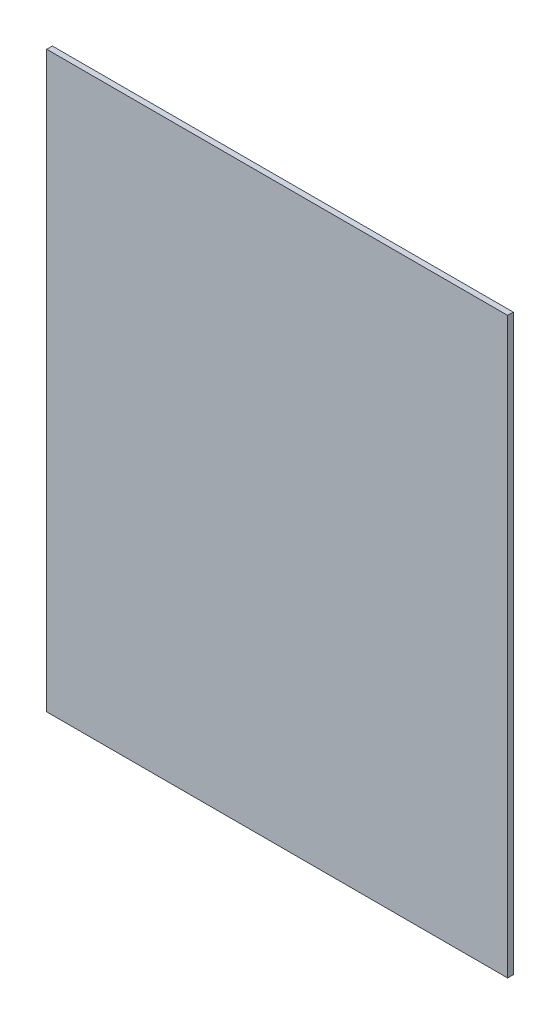
from build123d import *

# Parameters (mm, degrees)
SKETCH1_W           = 400
SKETCH1_H           = 498
BOSS_EXTRUDE1_DEPTH = 4.9


with BuildPart() as part:
    # Sketch1 → Boss-Extrude1 (new body)
    with BuildSketch(Plane.XY):
        with Locations((200, 249)):
            Rectangle(SKETCH1_W, SKETCH1_H)
    extrude(amount=BOSS_EXTRUDE1_DEPTH)


solid = part.part
